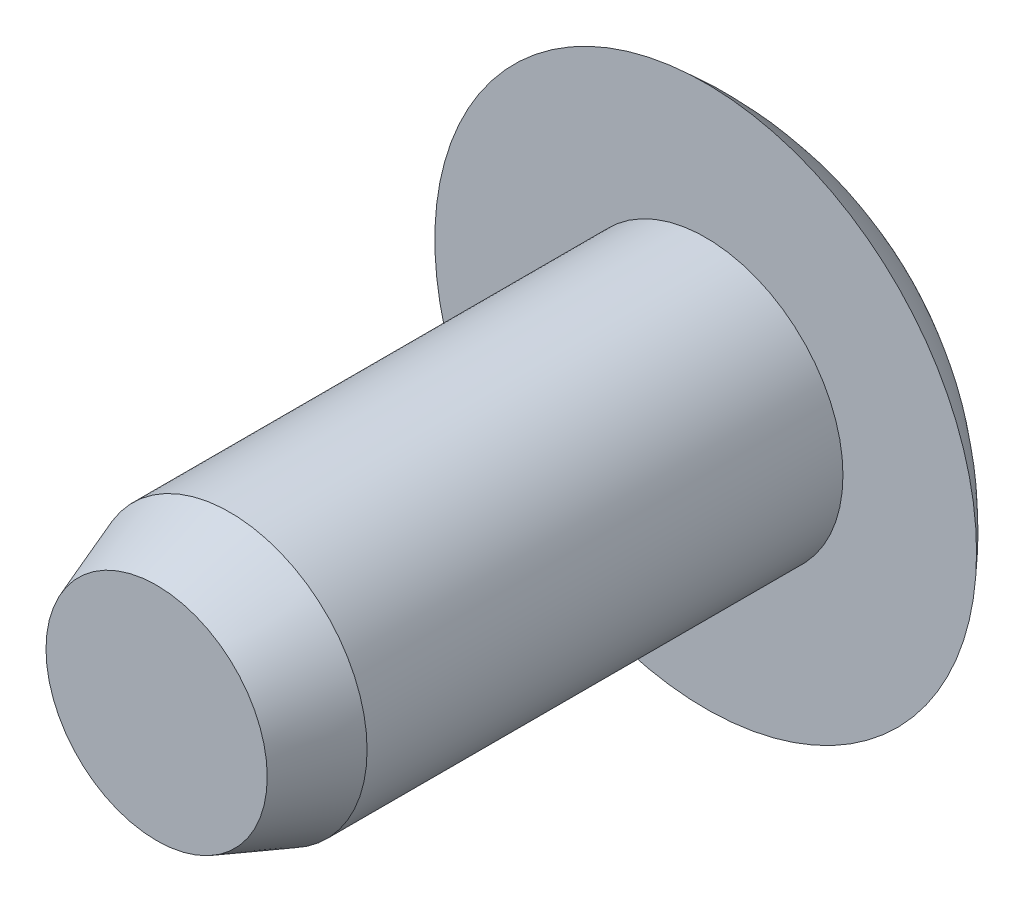
from build123d import *

# Parameters (mm, degrees)
CHAMFER1_SIZE  = 0.635
CHAMFER1_SIZE2 = 0.231121099


with BuildPart() as part:
    # Sketch1 → Revolve1 (revolve)
    with BuildSketch(Plane(origin=(0, 0, 0), x_dir=(1, 0, 0), z_dir=(0, 1, 0))):
        with BuildLine():
            Line((0, 0), (1.190625, 0))
            Line((1.190625, 0), (1.190625, 4.7625))
            Line((1.190625, 4.7625), (2.3495, 4.7625))
            ThreePointArc((2.3495, 4.7625), (1.29281384, 5.559212475), (0, 5.842))
            Line((0, 5.842), (0, 0))
        make_face()
    revolve(axis=Axis((0, 0, 0), (0, 0, -1)))

    # Chamfer1
    chamfer1_edges = [part.edges().sort_by_distance(p)[0] for p in [
        (-1.190625, 0, 0),
    ]]
    chamfer1_side = [part.faces().sort_by_distance(p)[0] for p in [
        (-1.190625, 0, -2.38125),
    ]]
    chamfer(chamfer1_edges, length=CHAMFER1_SIZE, length2=CHAMFER1_SIZE2, reference=chamfer1_side[0])


solid = part.part
